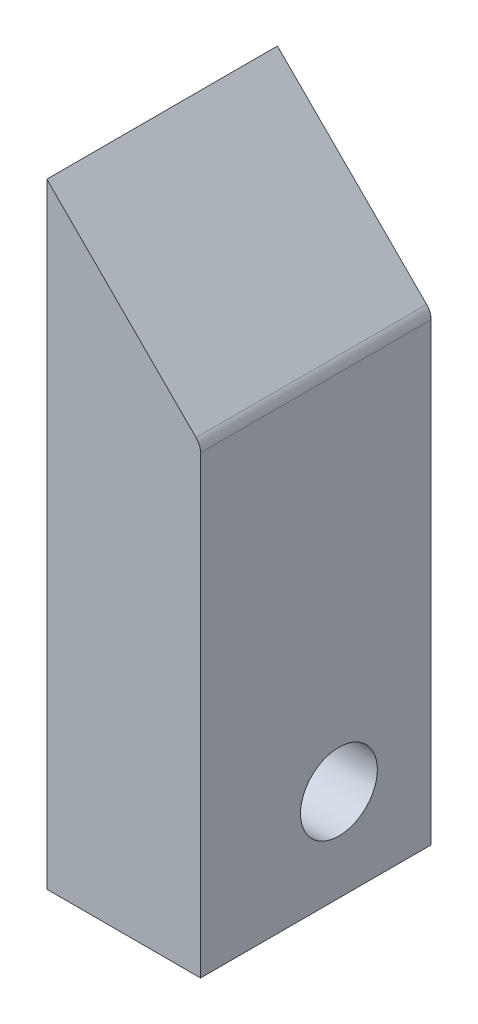
from build123d import *

# Parameters (mm, degrees)
RESSALTO_EXTRUS_O1_DEPTH = 15
ESBO_O2_R                = 2.5
CORTE_EXTRUS_O1_DEPTH    = 44.874821937
ESBO_O3_R                = 2.5
CORTE_EXTRUS_O2_DEPTH    = 6
FILETE1_R                = 1


with BuildPart() as part:
    # Esboço1 → Ressalto-extrusão1 (new body)
    with BuildSketch(Plane.XY):
        Polygon((0, 0), (0, 40), (10, 30), (10, 0), align=None)
    extrude(amount=RESSALTO_EXTRUS_O1_DEPTH)

    # Esboço2 → Corte-extrusão1 (cut, through all)
    with BuildSketch(Plane(origin=(10, 0, 0), x_dir=(0, 0, -1), z_dir=(1, 0, 0))):
        with Locations(Location((-6, 6, 0), (0, 0, 90))):
            Circle(ESBO_O2_R)
    extrude(amount=-CORTE_EXTRUS_O1_DEPTH, mode=Mode.SUBTRACT)

    # Esboço3 → Corte-extrusão2 (cut)
    with BuildSketch(Plane(origin=(0, 0, 0), x_dir=(-1, 0, 0), z_dir=(0, 0, -1))):
        with Locations((-2.5, 6)):
            Circle(ESBO_O3_R)
        with BuildLine():
            Line((0, 8.5), (-2.5, 8.5))
            ThreePointArc((-2.5, 8.5), (-0.732233047, 7.767766953), (0, 6))
            Line((0, 6), (0, 8.5))
        make_face()
        with BuildLine():
            Line((0, 3.5), (0, 6))
            ThreePointArc((0, 6), (-0.732233047, 4.232233047), (-2.5, 3.5))
            Line((-2.5, 3.5), (0, 3.5))
        make_face()
    extrude(amount=-CORTE_EXTRUS_O2_DEPTH, mode=Mode.SUBTRACT)

    # Filete1
    filete1_edges = [part.edges().sort_by_distance(p)[0] for p in [
        (10, 30, 7.5),
    ]]
    fillet(filete1_edges, radius=FILETE1_R)


solid = part.part
